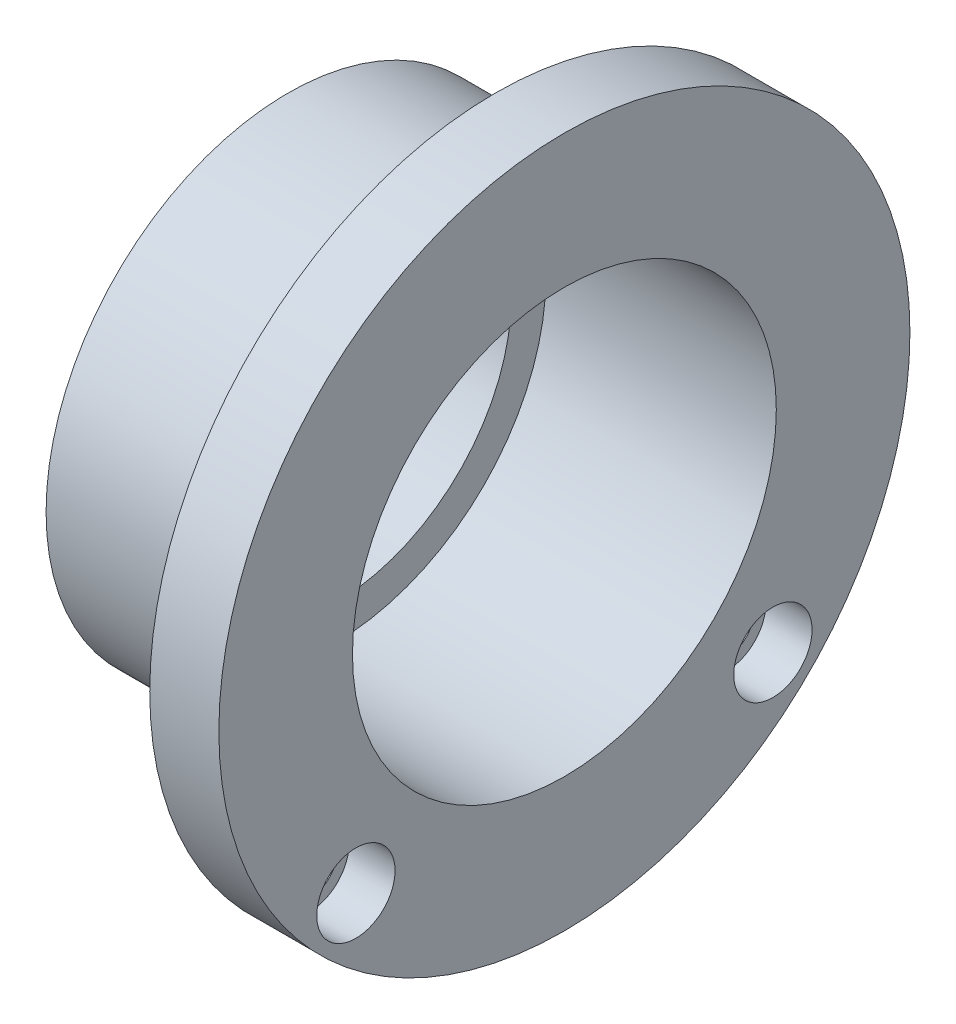
from build123d import *

# Parameters (mm, degrees)
SKETCH3_R          = 6
CUT_EXTRUDE2_DEPTH = 16
SKETCH4_R          = 8.5
CUT_EXTRUDE3_DEPTH = 10


with BuildPart() as part:
    # Sketch1 → Revolve1 (revolve)
    with BuildSketch(Plane.XY, mode=Mode.PRIVATE) as revolve1_sk:
        Polygon((-90.158227848, -16.376582278), (-100.158227848, -16.376582278), (-100.158227848, -2.376582278), (-55.158227848, -2.376582278), (-55.158227848, 20.123417722), (-40.158227848, 20.123417722), (-40.158227848, -8.876582278), (-90.158227848, -8.876582278), align=None)
    revolve(revolve1_sk.sketch.rotate(Axis((-100.158227848, -54.876582278, 0), (1, 0, 0)), 90), axis=Axis((-100.158227848, -54.876582278, 0), (1, 0, 0)))

    # Sketch3 → Cut-Extrude2 (cut)
    with BuildSketch(Plane(origin=(-40.158227848, 0, 0), x_dir=(0, 0, -1), z_dir=(1, 0, 0))):
        with Locations((45.254833996, -100.131416274)):
            Circle(SKETCH3_R)
        with Locations(Location((-45.254833996, -100.131416274, 0), (0, 0, 180))):
            Circle(SKETCH3_R)
    extrude(amount=-CUT_EXTRUDE2_DEPTH, mode=Mode.SUBTRACT)

    # Sketch4 → Cut-Extrude3 (cut)
    with BuildSketch(Plane(origin=(-40.158227848, 0, 0), x_dir=(0, 0, -1), z_dir=(1, 0, 0))):
        with Locations((-45.254833996, -100.131416274)):
            Circle(SKETCH4_R)
        with Locations((45.254833996, -100.131416274)):
            Circle(SKETCH4_R)
    extrude(amount=-CUT_EXTRUDE3_DEPTH, mode=Mode.SUBTRACT)


solid = part.part
